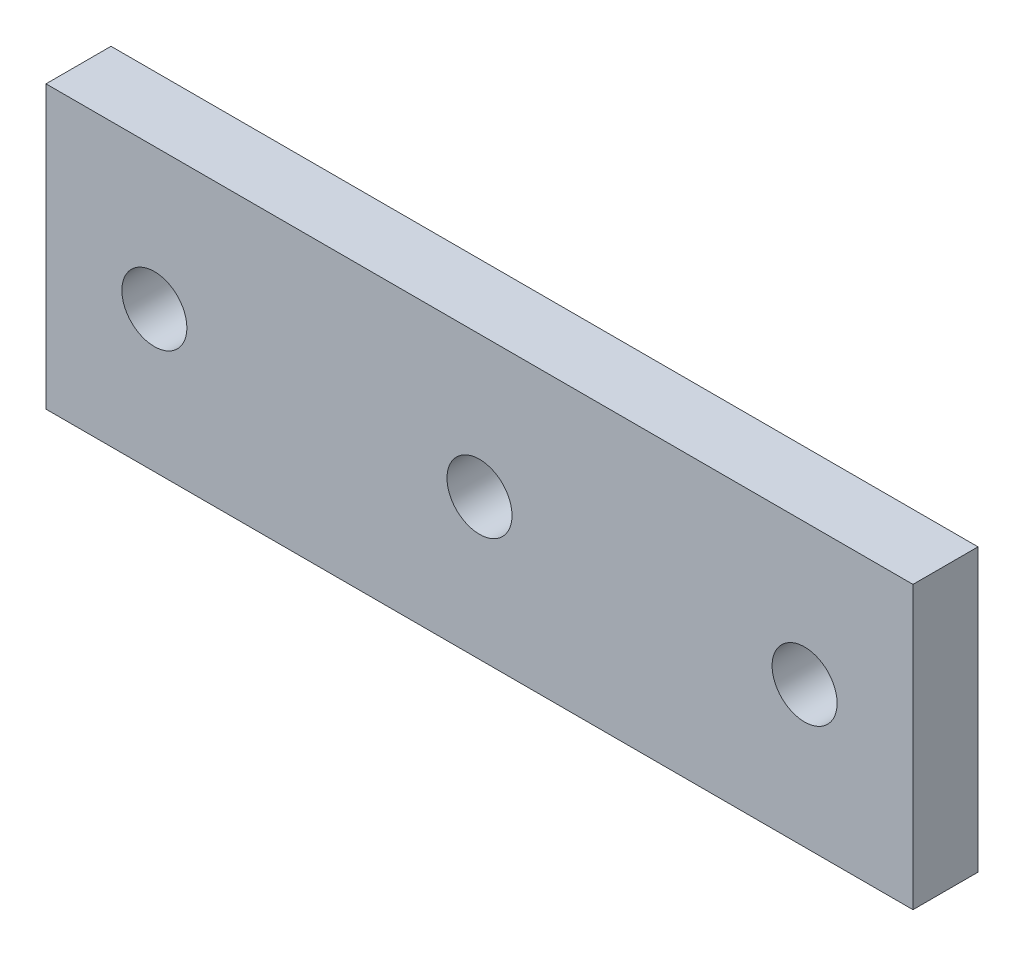
from build123d import *

# Parameters (mm, degrees)
SKETCH_1_W      = 40
SKETCH_1_H      = 13
SKETCH_1_R      = 1.5
EXTRUDE_1_DEPTH = 3


with BuildPart() as part:
    # 草圖1 → 填料-伸長1 (new body)
    with BuildSketch(Plane.XY):
        Rectangle(SKETCH_1_W, SKETCH_1_H)
        Circle(SKETCH_1_R, mode=Mode.SUBTRACT)
        with Locations((-15, 0)):
            Circle(SKETCH_1_R, mode=Mode.SUBTRACT)
        with Locations((15, 0)):
            Circle(SKETCH_1_R, mode=Mode.SUBTRACT)
    extrude(amount=EXTRUDE_1_DEPTH)


solid = part.part
